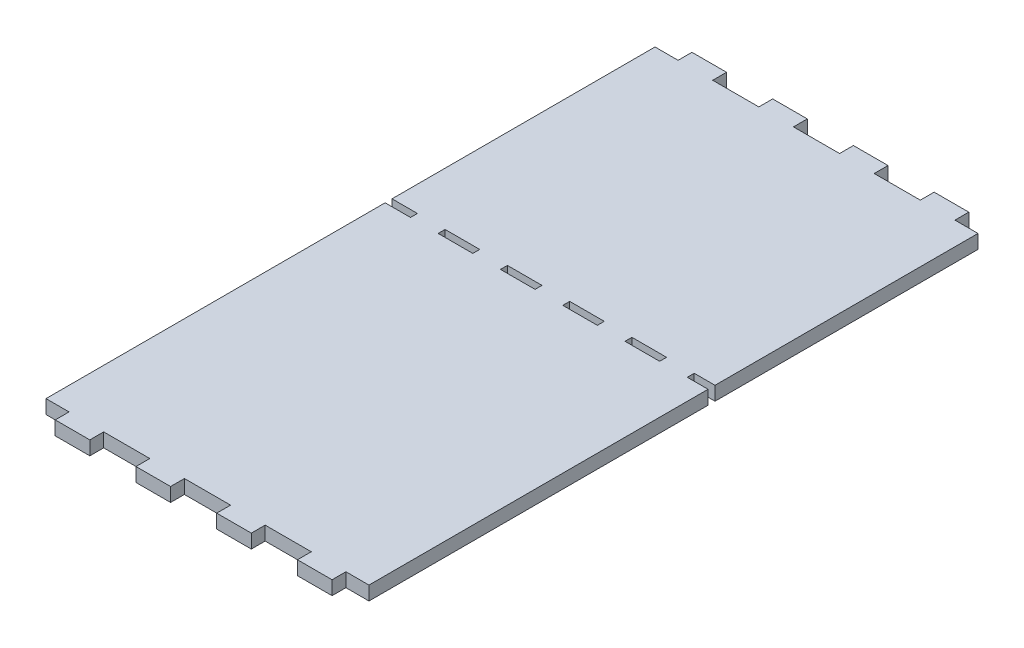
from build123d import *

# Parameters (mm, degrees)
ESQUISSE1_W             = 15
ESQUISSE1_H             = 6
BOSS_EXTRU_1_DEPTH      = 6
ESQUISSE2_W             = 15
ESQUISSE2_H             = 3
ENL_V_MAT_EXTRU_1_DEPTH = 6


with BuildPart() as part:
    # Esquisse1 → Boss.-Extru.1 (new body)
    with BuildSketch(Plane(origin=(0, 0, 0), x_dir=(1, 0, 0), z_dir=(0, 1, 0))):
        with Locations((-122.5, 273)):
            Rectangle(ESQUISSE1_W, ESQUISSE1_H)
        with Locations((-87.5, 273)):
            Rectangle(ESQUISSE1_W, ESQUISSE1_H)
        with Locations((-52.5, 273)):
            Rectangle(ESQUISSE1_W, ESQUISSE1_H)
        with Locations((-17.5, 273)):
            Rectangle(ESQUISSE1_W, ESQUISSE1_H)
        Polygon((-140, 270), (-140, 138), (0, 138), (0, 270), (-10, 270), (-25, 270), (-45, 270), (-60, 270), (-80, 270), (-95, 270), (-115, 270), (-130, 270), align=None)
        Polygon((0, 138), (-140, 138), (-140, 6), (-130, 6), (-115, 6), (-95, 6), (-80, 6), (-60, 6), (-45, 6), (-25, 6), (-10, 6), (0, 6), align=None)
        with Locations((-122.5, 3)):
            Rectangle(ESQUISSE1_W, ESQUISSE1_H)
        with Locations((-87.5, 3)):
            Rectangle(ESQUISSE1_W, ESQUISSE1_H)
        with Locations((-52.5, 3)):
            Rectangle(ESQUISSE1_W, ESQUISSE1_H)
        with Locations((-17.5, 3)):
            Rectangle(ESQUISSE1_W, ESQUISSE1_H)
    extrude(amount=BOSS_EXTRU_1_DEPTH)

    # Esquisse2 → Enlèv. mat.-Extru.1 (cut)
    with BuildSketch(Plane.XZ):
        with Locations((-1.5, -154.5)):
            Rectangle(ESQUISSE2_W, ESQUISSE2_H)
        with Locations((-28.5, -154.5)):
            Rectangle(ESQUISSE2_W, ESQUISSE2_H)
        with Locations((-55.5, -154.5)):
            Rectangle(ESQUISSE2_W, ESQUISSE2_H)
        with Locations((-82.5, -154.5)):
            Rectangle(ESQUISSE2_W, ESQUISSE2_H)
        with Locations((-109.5, -154.5)):
            Rectangle(ESQUISSE2_W, ESQUISSE2_H)
        with Locations((-136.5, -154.5)):
            Rectangle(ESQUISSE2_W, ESQUISSE2_H)
    extrude(amount=-ENL_V_MAT_EXTRU_1_DEPTH, mode=Mode.SUBTRACT)


solid = part.part
